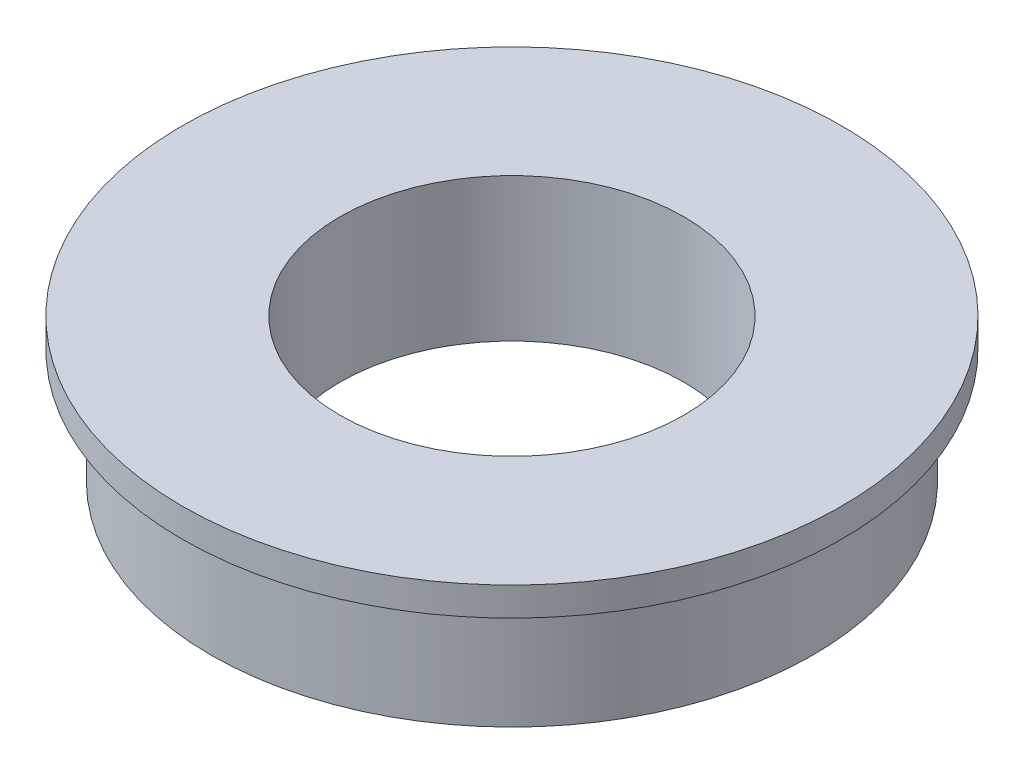
from build123d import *


with BuildPart() as part:
    # Sketch1 → Revolve1 (revolve)
    with BuildSketch(Plane(origin=(0, 0, 0), x_dir=(0, 0, -1), z_dir=(1, 0, 0)), mode=Mode.PRIVATE) as revolve1_sk:
        Polygon((11.5, -1.067727847), (11.5, -2.067727847), (10.5, -2.067727847), (10.5, -6.067727847), (6, -6.067727847), (6, -1.067727847), align=None)
    revolve(revolve1_sk.sketch.rotate(Axis((0, 4.005851113, 0), (0, -1, 0)), 180), axis=Axis((0, 4.005851113, 0), (0, -1, 0)))


solid = part.part
